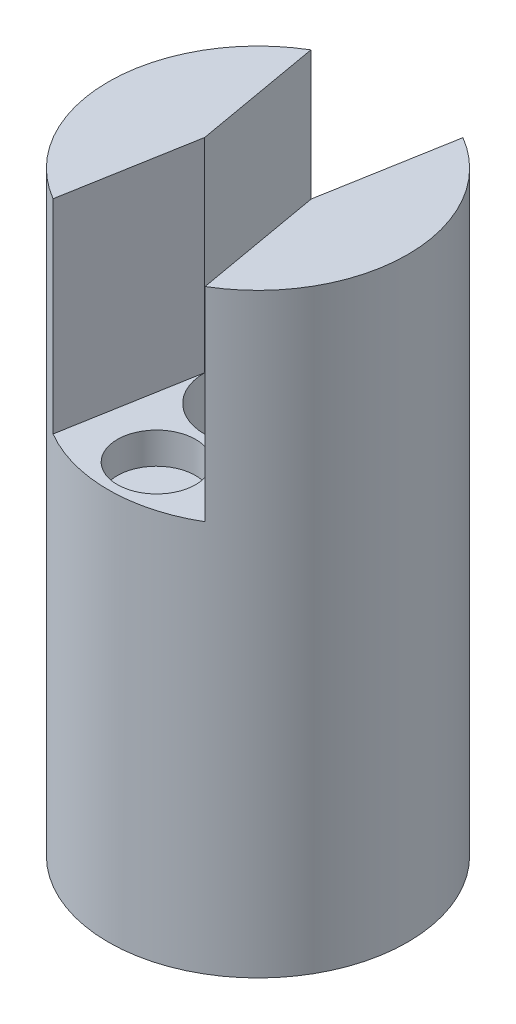
from build123d import *

# Parameters (mm, degrees)
SKETCH1_R             = 2.5
BOSS_EXTRUDE1_DEPTH   = 25
BOSS_EXTRUDE1_2_DEPTH = 25
BOSS_EXTRUDE2_DEPTH   = 38
SKETCH1_4_R           = 2.5
BOSS_EXTRUDE3_DEPTH   = 23
SKETCH1_5_R           = 3.4
SKETCH1_5_R_2         = 1
BOSS_EXTRUDE4_DEPTH   = 20


with BuildPart() as part:
    # Sketch1 → Boss-Extrude1 (new body)
    with BuildSketch(Plane(origin=(0, 0, 0), x_dir=(1, 0, 0), z_dir=(0, 1, 0))):
        with BuildLine():
            ThreePointArc((-3.4, 0), (0, 3.4), (3.4, 0))
            Line((3.4, 0), (4.85054735, 8.226462813))
            ThreePointArc((4.85054735, 8.226462813), (0, 9.55), (-4.85054735, 8.226462813))
            Line((-4.85054735, 8.226462813), (-3.4, 0))
        make_face()
        with Locations(Location((0, 6.475, 0), (0, 0, 270))):
            Circle(SKETCH1_R, mode=Mode.SUBTRACT)
    extrude(amount=BOSS_EXTRUDE1_DEPTH)



with BuildPart() as body_2:
    # Sketch1 → Boss-Extrude1 2 (new body)
    with BuildSketch(Plane(origin=(0, 0, 0), x_dir=(1, 0, 0), z_dir=(0, 1, 0))):
        with BuildLine():
            Line((4.85054735, -8.226462813), (3.4, 0))
            ThreePointArc((3.4, 0), (0, -3.4), (-3.4, 0))
            Line((-3.4, 0), (-4.85054735, -8.226462813))
            ThreePointArc((-4.85054735, -8.226462813), (0, -9.55), (4.85054735, -8.226462813))
        make_face()
        with Locations(Location((0, -6.475, 0), (0, 0, 270))):
            Circle(SKETCH1_R, mode=Mode.SUBTRACT)
    extrude(amount=BOSS_EXTRUDE1_2_DEPTH)


with BuildPart() as part_1:
    add(part.part)

    add(body_2.part)  # Boss-Extrude2 merges body 2
    # Sketch1<3> → Boss-Extrude2 (add)
    with BuildSketch(Plane(origin=(0, 0, 0), x_dir=(1, 0, 0), z_dir=(0, 1, 0))):
        with BuildLine():
            Line((4.85054735, 8.226462813), (3.4, 0))
            Line((3.4, 0), (4.85054735, -8.226462813))
            ThreePointArc((4.85054735, -8.226462813), (8.292322569, -4.737075723), (9.55, 0))
            ThreePointArc((9.55, 0), (8.292322569, 4.737075723), (4.85054735, 8.226462813))
        make_face()
        with BuildLine():
            Line((-4.85054735, -8.226462813), (-3.4, 0))
            Line((-3.4, 0), (-4.85054735, 8.226462813))
            ThreePointArc((-4.85054735, 8.226462813), (-9.55, 0), (-4.85054735, -8.226462813))
        make_face()
    extrude(amount=BOSS_EXTRUDE2_DEPTH)

    # Sketch1<4> → Boss-Extrude3 (add)
    with BuildSketch(Plane(origin=(0, 0, 0), x_dir=(1, 0, 0), z_dir=(0, 1, 0))):
        with Locations(Location((0, -6.475, 0), (0, 0, 270))):
            Circle(SKETCH1_4_R)
        with Locations(Location((0, 6.475, 0), (0, 0, 270))):
            Circle(SKETCH1_4_R)
    extrude(amount=BOSS_EXTRUDE3_DEPTH)

    # Sketch1<5> → Boss-Extrude4 (add)
    with BuildSketch(Plane(origin=(0, 0, 0), x_dir=(1, 0, 0), z_dir=(0, 1, 0))):
        Circle(SKETCH1_5_R)
        with Locations(Location((0, 0, 0), (0, 0, 270))):
            Circle(SKETCH1_5_R_2, mode=Mode.SUBTRACT)
    extrude(amount=BOSS_EXTRUDE4_DEPTH)


solid = part_1.part
